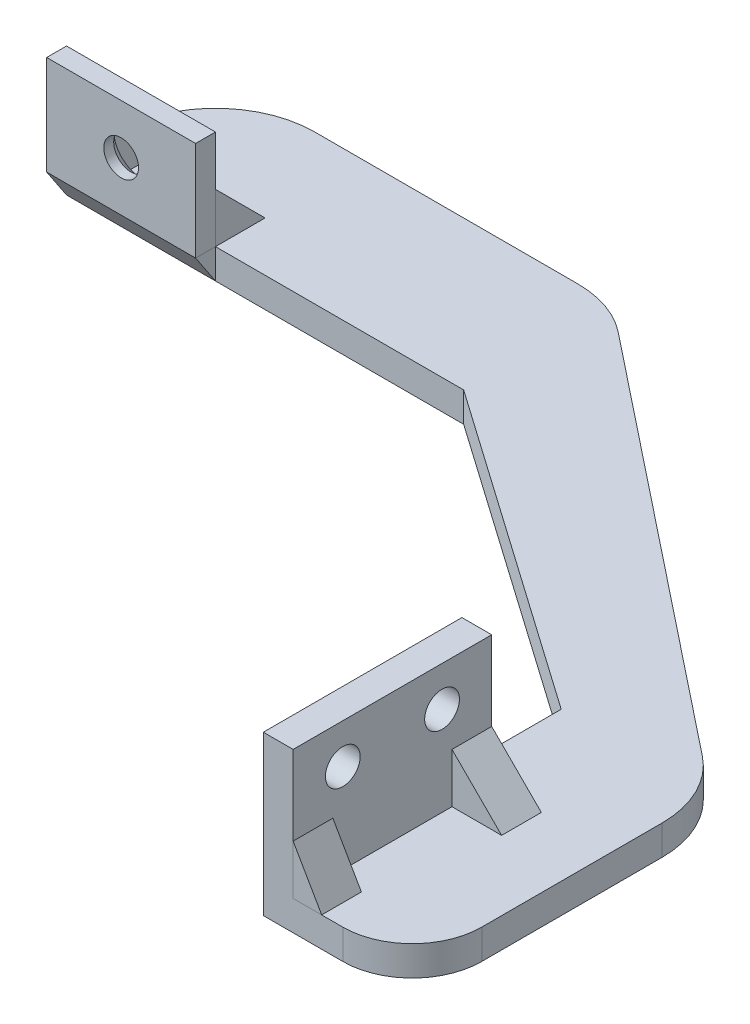
from build123d import *

# Parameters (mm, degrees)
BASE_EXT_DEPTH            = 3
MOUNTING_PLATE_W          = 15
MOUNTING_PLATE_H          = 2
LED_BOX_PLATE_EXT_DEPTH   = 10
BOSS_EXTRUDE6_DEPTH       = 4
BOSS_EXTRUDE9_DEPTH       = 4
BOSS_EXTRUDE11_DEPTH      = 15
M3_SCREW_R                = 1.75
CUT_EXTRUDE3_DEPTH        = 87.972462143
SKETCH13_W                = 3
SKETCH13_H                = 20
MOUNT_PLATE_BOX_EXT_DEPTH = 13
BOSS_EXTRUDE12_DEPTH      = 4
BOSS_EXTRUDE15_DEPTH      = 4
M3_SCREWS_R               = 1.75
M3_SCREW_CUT_DEPTH        = 8
FILLET1_R                 = 10
FILLET2_R                 = 7
FILLET3_R                 = 10
FILLET4_R                 = 10


with BuildPart() as part:
    # Base → Base EXT (new body)
    with BuildSketch(Plane(origin=(0, 0, 0), x_dir=(1, 0, 0), z_dir=(0, 1, 0))):
        Polygon((20, 7.5), (67.766081772, -30.443057454), (67.766081772, -60.443057454), (52.766081772, -60.443057454), (52.766081772, -30.443057454), (20, -7.5), (-20, -7.5), (-20, 7.5), align=None)
    extrude(amount=BASE_EXT_DEPTH)

    # Sketch17 → Boss-Extrude9 (add)
    with BuildSketch(Plane(origin=(-5, 0, 0), x_dir=(0, 0, -1), z_dir=(1, 0, 0))):
        Polygon((-7.5, 8), (-2.5, 3), (-7.5, 3), align=None)
    extrude(amount=-BOSS_EXTRUDE9_DEPTH)

    # Sketch13 → Mount Plate BOX EXT (add)
    with BuildSketch(Plane(origin=(0, 3, 0), x_dir=(1, 0, 0), z_dir=(0, 1, 0))):
        with Locations((54.266081772, -50.443057454)):
            Rectangle(SKETCH13_W, SKETCH13_H)
    extrude(amount=MOUNT_PLATE_BOX_EXT_DEPTH)

    # Sketch21 → Boss-Extrude15 (add)
    with BuildSketch(Plane(origin=(0, 0, 40.443057454), x_dir=(-1, 0, 0), z_dir=(0, 0, -1))):
        Polygon((-55.766081772, 8), (-60.766081772, 3), (-55.766081772, 3), align=None)
    extrude(amount=-BOSS_EXTRUDE15_DEPTH)

    # M3 Screws → M3 Screw Cut (cut)
    with BuildSketch(Plane(origin=(55.766081772, 0, 0), x_dir=(0, 0, -1), z_dir=(1, 0, 0))):
        with Locations((-55.443057454, 12)):
            Circle(M3_SCREWS_R)
        with Locations((-45.443057454, 12)):
            Circle(M3_SCREWS_R)
    extrude(amount=-M3_SCREW_CUT_DEPTH, mode=Mode.SUBTRACT)

    # Fillet1
    fillet1_edges = [part.edges().sort_by_distance(p)[0] for p in [
        (-20, 1.5, -7.5),
    ]]
    fillet(fillet1_edges, radius=FILLET1_R)

    # Fillet2
    fillet2_edges = [part.edges().sort_by_distance(p)[0] for p in [
        (67.766081772, 1.5, 60.443057454),
    ]]
    fillet(fillet2_edges, radius=FILLET2_R)

    # Fillet3
    fillet3_edges = [part.edges().sort_by_distance(p)[0] for p in [
        (67.766081772, 1.5, 30.443057454),
    ]]
    fillet(fillet3_edges, radius=FILLET3_R)

    # Fillet4
    fillet4_edges = [part.edges().sort_by_distance(p)[0] for p in [
        (20, 1.5, -7.5),
    ]]
    fillet(fillet4_edges, radius=FILLET4_R)


with BuildPart() as body_2:
    # Mounting Plate → LED Box Plate EXT (new body)
    with BuildSketch(Plane(origin=(0, 3, 0), x_dir=(1, 0, 0), z_dir=(0, 1, 0))):
        with Locations((-12.5, -8.5)):
            Rectangle(MOUNTING_PLATE_W, MOUNTING_PLATE_H)
    extrude(amount=LED_BOX_PLATE_EXT_DEPTH)

    # M3 Screw → Cut-Extrude3 (cut, through all)
    with BuildSketch(Plane(origin=(0, 0, 7.5), x_dir=(-1, 0, 0), z_dir=(0, 0, -1))):
        with Locations((12.5, 8)):
            Circle(M3_SCREW_R)
    extrude(amount=-CUT_EXTRUDE3_DEPTH, mode=Mode.SUBTRACT)

    # Cut-Extrude4 cone 1 section (through the dimple's axis) → Cut-Extrude4 (revolve, cut)
    with BuildSketch(Plane(origin=(-12.5, 8, 7.5), x_dir=(0, 1, 0), z_dir=(1, 0, 0))):
        Polygon((0, 0), (2.75, 0), (0, 2.75), align=None)
    revolve(axis=Axis((-12.5, 8, 7.5), (0, 0, 1)), mode=Mode.SUBTRACT)


with BuildPart() as body_3:
    # Sketch16 → Boss-Extrude6 (new body)
    with BuildSketch(Plane.ZY.offset(20)):
        Polygon((2.5, 3), (7.5, 8), (7.5, 3), align=None)
    extrude(amount=-BOSS_EXTRUDE6_DEPTH)


with BuildPart() as body_4:
    # Sketch18 → Boss-Extrude11 (new body)
    with BuildSketch(Plane.ZY.offset(20)):
        Polygon((7.5, 0), (9.5, 3), (7.5, 3), align=None)
    extrude(amount=-BOSS_EXTRUDE11_DEPTH)


with BuildPart() as body_5:
    # Sketch20 → Boss-Extrude12 (new body)
    with BuildSketch(Plane.XY.offset(60.443057454)):
        Polygon((55.766081772, 8), (58.641777725, 3), (55.766081772, 3), align=None)
    extrude(amount=-BOSS_EXTRUDE12_DEPTH)


solid = Compound([part.part, body_2.part, body_3.part, body_4.part, body_5.part])
